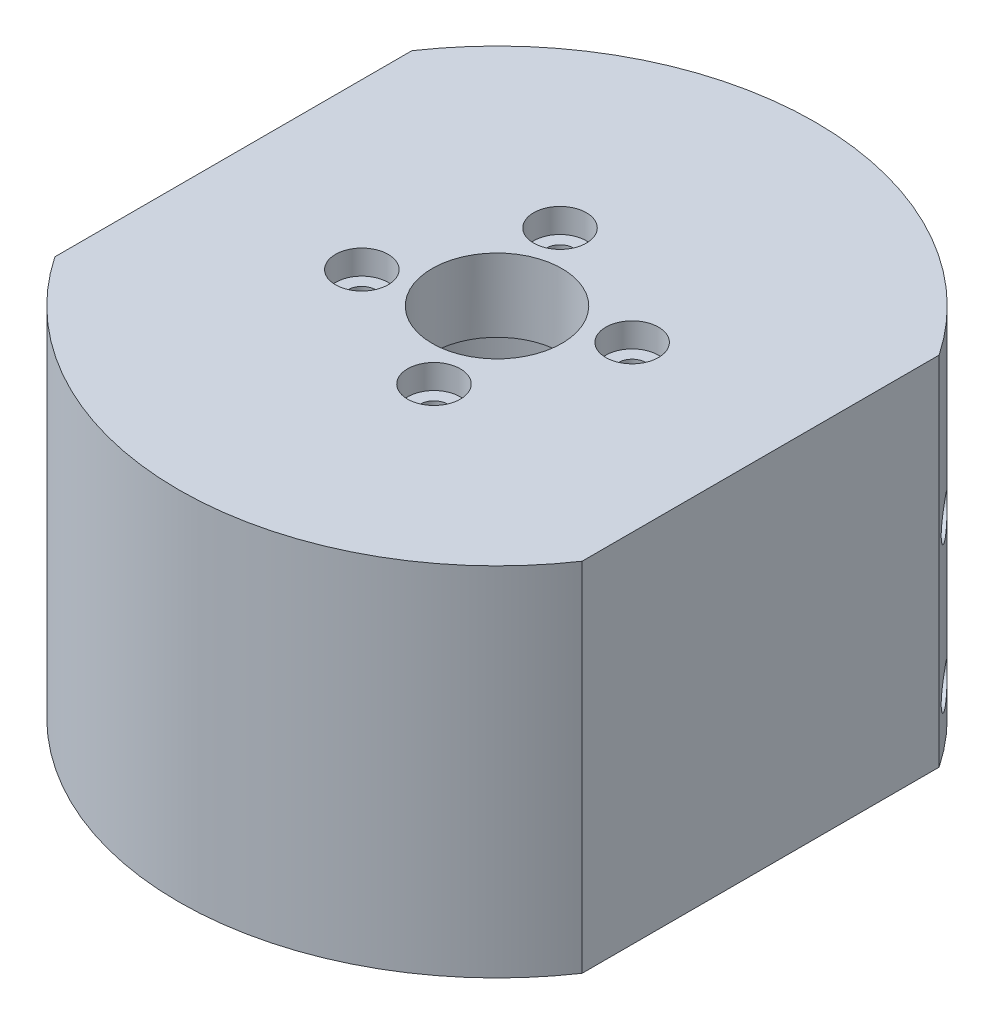
from build123d import *

# Parameters (mm, degrees)
BOSS_EXTRUDE1_DEPTH            = 44
CBORE_FOR_M3_SHCS1_D           = 3.4
CBORE_FOR_M3_SHCS1_CBORE_D     = 6.5
CBORE_FOR_M3_SHCS1_CBORE_DEPTH = 3
CIRPATTERN1_COUNT              = 4
SKETCH4_R                      = 16.2
CUT_EXTRUDE1_DEPTH             = 35
SKETCH5_R                      = 8
CUT_EXTRUDE2_DEPTH             = 67.748127315
BOSS_EXTRUDE2_DEPTH            = 44
CBORE_FOR_M4_SHCS1_D           = 4.3
CBORE_FOR_M4_SHCS1_DEPTH       = 100.101198794
CBORE_FOR_M4_SHCS1_CBORE_D     = 8
CBORE_FOR_M4_SHCS1_CBORE_DEPTH = 4
CBORE_FOR_M4_SHCS1_TIP         = 1.291850331


with BuildPart() as part:
    # Sketch1 → Boss-Extrude1 (new body)
    with BuildSketch(Plane(origin=(0, 0, 0), x_dir=(1, 0, 0), z_dir=(0, 1, 0))):
        with BuildLine():
            Line((-32.5, 20.169593452), (-32.5, -20.169593452))
            ThreePointArc((-32.5, -20.169593452), (0, -38.25), (32.5, -20.169593452))
            Line((32.5, -20.169593452), (32.5, 20.169593452))
            ThreePointArc((32.5, 20.169593452), (0, 38.25), (-32.5, 20.169593452))
        make_face()
    extrude(amount=BOSS_EXTRUDE1_DEPTH)

    # CBORE for M3 SHCS1 (through all)
    with Locations(Plane(origin=(0, 44, 0), x_dir=(1, 0, 0), z_dir=(0, 1, 0))):
        with Locations((-4.446261863, 12.21600407)):
            cbore_for_m3_shcs1 = CounterBoreHole(CBORE_FOR_M3_SHCS1_D / 2, CBORE_FOR_M3_SHCS1_CBORE_D / 2, CBORE_FOR_M3_SHCS1_CBORE_DEPTH)

    # CirPattern1: CBORE for M3 SHCS1 ×4 about axis
    cirpattern1_axis = Axis((0, 0, 0), (0, 1, 0))
    for i in range(1, CIRPATTERN1_COUNT):
        add(cbore_for_m3_shcs1.rotate(cirpattern1_axis, i * 360 / CIRPATTERN1_COUNT), mode=Mode.SUBTRACT)

    # Sketch4 → Cut-Extrude1 (cut)
    with BuildSketch(Plane.XZ):
        with Locations(Location((0, 0, 0), (0, 0, 270))):
            Circle(SKETCH4_R)
    extrude(amount=-CUT_EXTRUDE1_DEPTH, mode=Mode.SUBTRACT)

    # Sketch5 → Cut-Extrude2 (cut, through all)
    with BuildSketch(Plane(origin=(0, 44, 0), x_dir=(1, 0, 0), z_dir=(0, 1, 0))):
        with Locations(Location((0, 0, 0), (0, 0, 270))):
            Circle(SKETCH5_R)
    extrude(amount=-CUT_EXTRUDE2_DEPTH, mode=Mode.SUBTRACT)

    # Sketch7 → Boss-Extrude2 (add)
    with BuildSketch(Plane.XZ):
        with BuildLine():
            Line((-32.5, 20.169593452), (-32.5, 22.007101127))
            ThreePointArc((-32.5, 22.007101127), (0, 39.25), (32.5, 22.007101127))
            Line((32.5, 22.007101127), (32.5, 20.169593452))
            ThreePointArc((32.5, 20.169593452), (0, 38.25), (-32.5, 20.169593452))
        make_face()
        with BuildLine():
            Line((32.5, -20.169593452), (32.5, -22.007101127))
            ThreePointArc((32.5, -22.007101127), (0, -39.25), (-32.5, -22.007101127))
            Line((-32.5, -22.007101127), (-32.5, -20.169593452))
            ThreePointArc((-32.5, -20.169593452), (0, -38.25), (32.5, -20.169593452))
        make_face()
    extrude(amount=-BOSS_EXTRUDE2_DEPTH)

    # CBORE for M4 SHCS1
    with Locations(Plane(origin=(-50.050599397, 499.724238547, -401.677021233), x_dir=(0, -0.9858598075393219, -0.16757219303491563), z_dir=(-1, 0, 0))):
        with Locations((405.876811742, 451.068889591), (423.622288278, 454.085189065)):
            CounterBoreHole(CBORE_FOR_M4_SHCS1_D / 2, CBORE_FOR_M4_SHCS1_CBORE_D / 2, CBORE_FOR_M4_SHCS1_CBORE_DEPTH, depth=CBORE_FOR_M4_SHCS1_DEPTH)
            with Locations((0, 0, -(CBORE_FOR_M4_SHCS1_DEPTH + CBORE_FOR_M4_SHCS1_TIP / 2))):  # 118° drill point
                Cone(0, CBORE_FOR_M4_SHCS1_D / 2, CBORE_FOR_M4_SHCS1_TIP, mode=Mode.SUBTRACT)


solid = part.part
